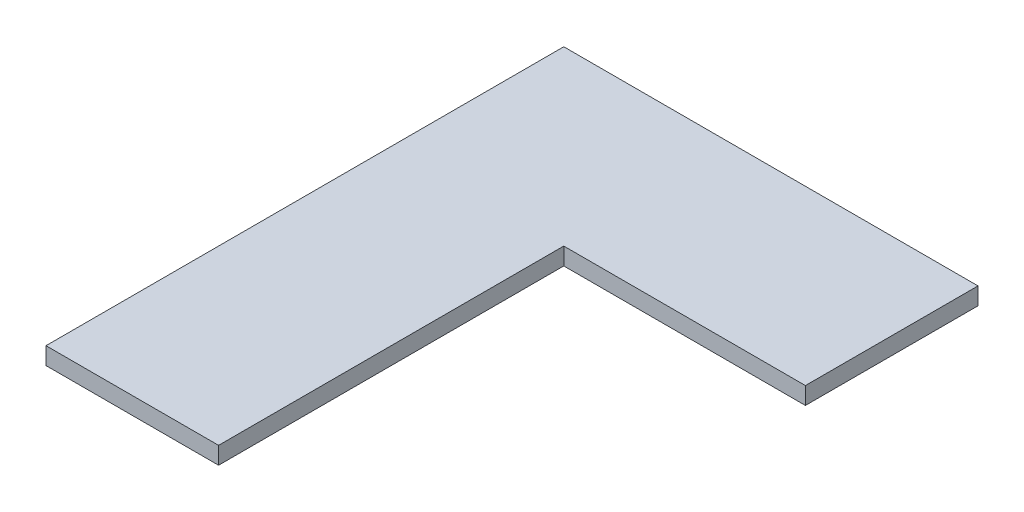
from build123d import *

# Parameters (mm, degrees)
SKETCH1_W           = 10
SKETCH1_H           = 30
SKETCH1_W_2         = 14
SKETCH1_H_2         = 10
BOSS_EXTRUDE1_DEPTH = 1


with BuildPart() as part:
    # Sketch1 → Boss-Extrude1 (new body)
    with BuildSketch(Plane(origin=(0, 0, 0), x_dir=(1, 0, 0), z_dir=(0, 1, 0))):
        with Locations((5, -15)):
            Rectangle(SKETCH1_W, SKETCH1_H)
        with Locations((17, -5)):
            Rectangle(SKETCH1_W_2, SKETCH1_H_2)
    extrude(amount=BOSS_EXTRUDE1_DEPTH)


solid = part.part
